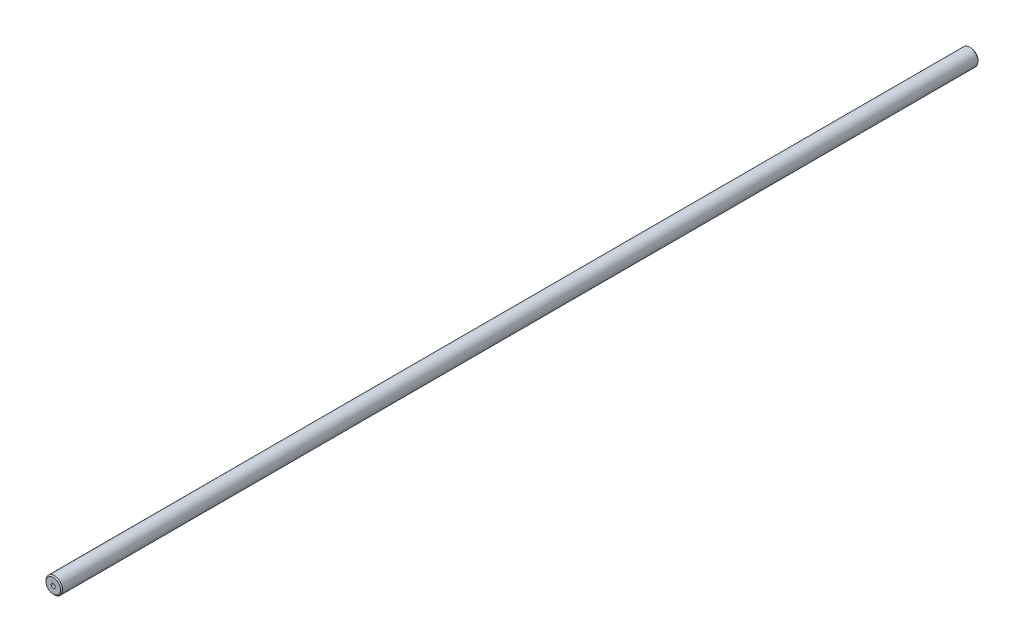
from build123d import *

# Parameters (mm, degrees)
SKETCH1_R           = 4
BOSS_EXTRUDE1_DEPTH = 441
SKETCH2_R           = 1
CUT_EXTRUDE1_DEPTH  = 10
CHAMFER1_SIZE       = 0.5


with BuildPart() as part:
    # Sketch1 → Boss-Extrude1 (new body)
    with BuildSketch(Plane.XY):
        Circle(SKETCH1_R)
    extrude(amount=BOSS_EXTRUDE1_DEPTH)

    # Sketch2 → Cut-Extrude1 (cut)
    with BuildSketch(Plane.XY.offset(441)):
        Circle(SKETCH2_R)
    extrude(amount=-CUT_EXTRUDE1_DEPTH, mode=Mode.SUBTRACT)

    # Chamfer1
    chamfer1_edges = [part.edges().sort_by_distance(p)[0] for p in [
        (-4, 0, 0),
        (-4, 0, 441),
    ]]
    chamfer(chamfer1_edges, length=CHAMFER1_SIZE)


solid = part.part
